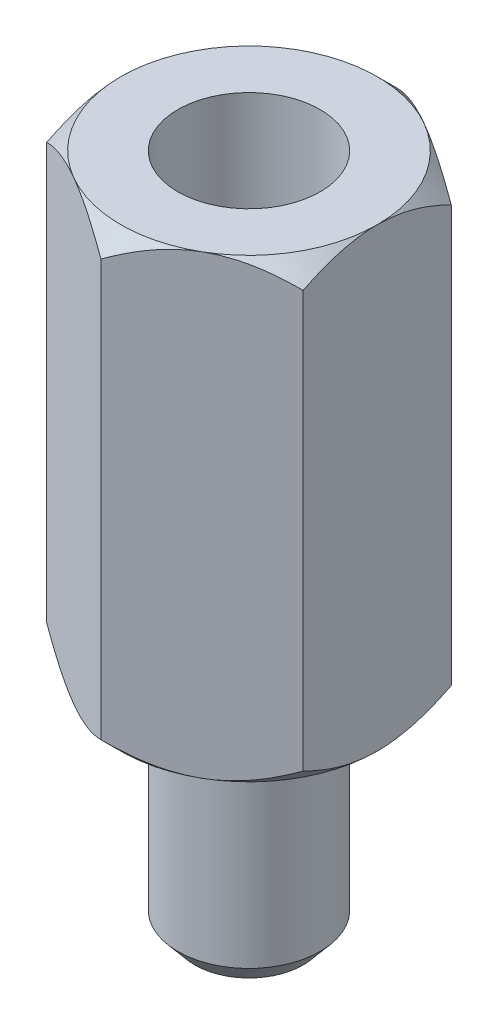
from build123d import *

# Parameters (mm, degrees)
SKETCH1_R           = 1.25
BOSS_EXTRUDE1_DEPTH = 3.9
BOSS_EXTRUDE2_DEPTH = 8
CUT_EXTRUDE1_START  = -4.8
SKETCH3_R           = 1.25
CUT_EXTRUDE1_DEPTH  = 4.8
SKETCH4_OUTSIDE_W   = 36.022
SKETCH4_OUTSIDE_H   = 36.718
SKETCH4_OUTSIDE_R   = 2.25
CUT_EXTRUDE2_DEPTH  = 13.386383653
CUT_EXTRUDE2_DRAFT  = -45
SKETCH5_OUTSIDE_W   = 28.662
SKETCH5_OUTSIDE_H   = 29.358
SKETCH5_OUTSIDE_R   = 2.25
CUT_EXTRUDE3_DEPTH  = 9.707037384
CUT_EXTRUDE3_DRAFT  = -45
CHAMFER1_SIZE       = 0.3
CHAMFER1_SIZE2      = 0.357526078


with BuildPart() as part:
    # Sketch1 → Boss-Extrude1 (new body)
    with BuildSketch(Plane(origin=(0, 0, 0), x_dir=(1, 0, 0), z_dir=(0, 1, 0))):
        with Locations(Location((0, 0, 0), (0, 0, 270))):
            Circle(SKETCH1_R)
    extrude(amount=BOSS_EXTRUDE1_DEPTH)

    # Sketch2 → Boss-Extrude2 (add)
    with BuildSketch(Plane(origin=(0, 3.9, 0), x_dir=(1, 0, 0), z_dir=(0, 1, 0))):
        Polygon((-2.25, -1.299038106), (0, -2.598076211), (2.25, -1.299038106), (2.25, 1.299038106), (0, 2.598076211), (-2.25, 1.299038106), align=None)
    extrude(amount=BOSS_EXTRUDE2_DEPTH)

    # Sketch3 → Cut-Extrude1 (cut)
    with BuildSketch(Plane(origin=(0, 11.9, 0), x_dir=(1, 0, 0), z_dir=(0, 1, 0)).offset(CUT_EXTRUDE1_START)):
        with Locations(Location((0, 0, 0), (0, 0, 270))):
            Circle(SKETCH3_R)
    extrude(amount=CUT_EXTRUDE1_DEPTH, mode=Mode.SUBTRACT)


with BuildPart() as cut_extrude2_tool:
    # Sketch4 outside → Cut-Extrude2 (with draft: the straight prism first)
    with BuildSketch(Plane(origin=(0, 11.9, 0), x_dir=(1, 0, 0), z_dir=(0, 1, 0))):
        Rectangle(SKETCH4_OUTSIDE_W, SKETCH4_OUTSIDE_H)
        Circle(SKETCH4_OUTSIDE_R, mode=Mode.SUBTRACT)
    extrude(amount=-CUT_EXTRUDE2_DEPTH)
    # Cut-Extrude2: the draft: its side faces are tilted about the plane it starts from
    cut_extrude2_sides = [cut_extrude2_tool.faces().sort_by_distance(p)[0] for p in [
        (0, 5.206808173, 18.359),
        (18.011, 5.206808173, 0),
        (0, 5.206808173, -18.359),
        (-18.011, 5.206808173, 0),
        (-2.25, 5.206808173, 0),
    ]]
    draft(cut_extrude2_sides, Plane(origin=(0, 11.9, 0), x_dir=(1, 0, 0), z_dir=(0, 1, 0)), CUT_EXTRUDE2_DRAFT)


with BuildPart() as part_1:
    add(part.part)

    # Cut-Extrude2: cut by cut_extrude2_tool
    add(cut_extrude2_tool.part, mode=Mode.SUBTRACT)


with BuildPart() as cut_extrude3_tool:
    # Sketch5 outside → Cut-Extrude3 (with draft: the straight prism first)
    with BuildSketch(Plane.XZ.offset(-3.9)):
        Rectangle(SKETCH5_OUTSIDE_W, SKETCH5_OUTSIDE_H)
        Circle(SKETCH5_OUTSIDE_R, mode=Mode.SUBTRACT)
    extrude(amount=-CUT_EXTRUDE3_DEPTH)
    # Cut-Extrude3: the draft: its side faces are tilted about the plane it starts from
    cut_extrude3_sides = [cut_extrude3_tool.faces().sort_by_distance(p)[0] for p in [
        (0, 8.753518692, -14.679),
        (14.331, 8.753518692, 0),
        (0, 8.753518692, 14.679),
        (-14.331, 8.753518692, 0),
        (-2.25, 8.753518692, 0),
    ]]
    draft(cut_extrude3_sides, Plane.XZ.offset(-3.9), CUT_EXTRUDE3_DRAFT)


with BuildPart() as part_2:
    add(part_1.part)

    # Cut-Extrude3: cut by cut_extrude3_tool
    add(cut_extrude3_tool.part, mode=Mode.SUBTRACT)

    # Chamfer1
    chamfer1_edges = [part_2.edges().sort_by_distance(p)[0] for p in [
        (0, 0, -1.25),
    ]]
    chamfer1_side = [part_2.faces().sort_by_distance(p)[0] for p in [
        (0, 0, 0),
    ]]
    chamfer(chamfer1_edges, length=CHAMFER1_SIZE, length2=CHAMFER1_SIZE2, reference=chamfer1_side[0])


solid = part_2.part
